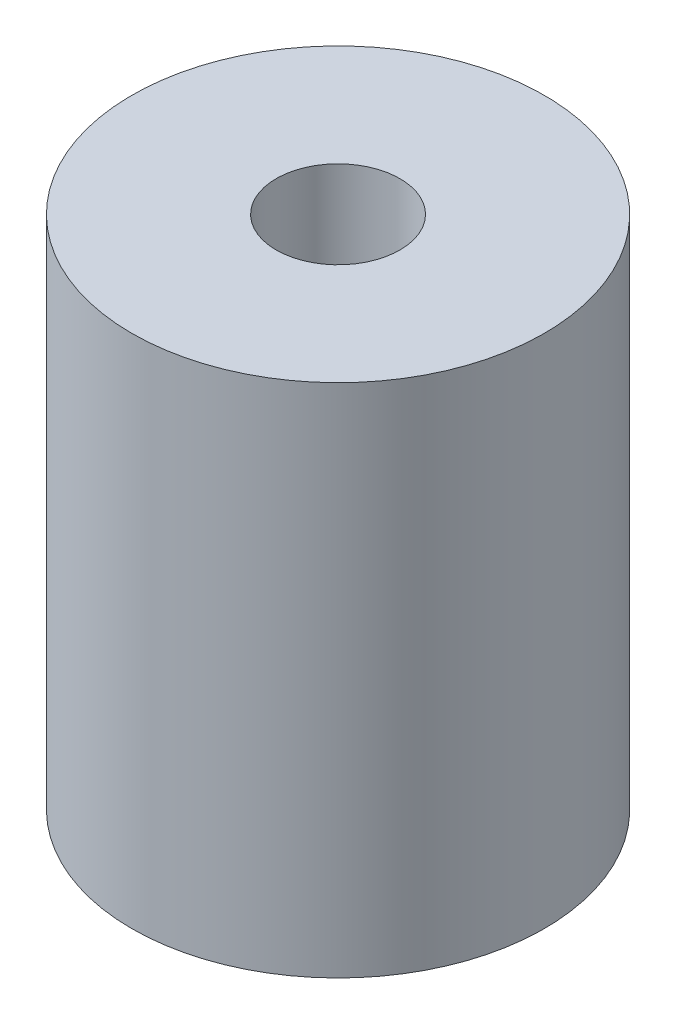
from build123d import *

# Parameters (mm, degrees)
SKETCH1_R           = 10
BOSS_EXTRUDE1_DEPTH = 25
SKETCH3_R           = 3
CUT_EXTRUDE1_DEPTH  = 29.722813233
SKETCH4_R           = 4.5
CUT_EXTRUDE2_DEPTH  = 10


with BuildPart() as part:
    # Sketch1 → Boss-Extrude1 (new body)
    with BuildSketch(Plane(origin=(0, 0, 0), x_dir=(1, 0, 0), z_dir=(0, 1, 0))):
        with Locations(Location((0, 0, 0), (0, 0, 270))):
            Circle(SKETCH1_R)
    extrude(amount=BOSS_EXTRUDE1_DEPTH)

    # Sketch3 → Cut-Extrude1 (cut, through all)
    with BuildSketch(Plane(origin=(0, 25, 0), x_dir=(1, 0, 0), z_dir=(0, 1, 0))):
        with Locations(Location((0, 0, 0), (0, 0, 270))):
            Circle(SKETCH3_R)
    extrude(amount=-CUT_EXTRUDE1_DEPTH, mode=Mode.SUBTRACT)

    # Sketch4 → Cut-Extrude2 (cut)
    with BuildSketch(Plane.XZ):
        with Locations(Location((0, 0, 0), (0, 0, 270))):
            Circle(SKETCH4_R)
    extrude(amount=-CUT_EXTRUDE2_DEPTH, mode=Mode.SUBTRACT)


solid = part.part
